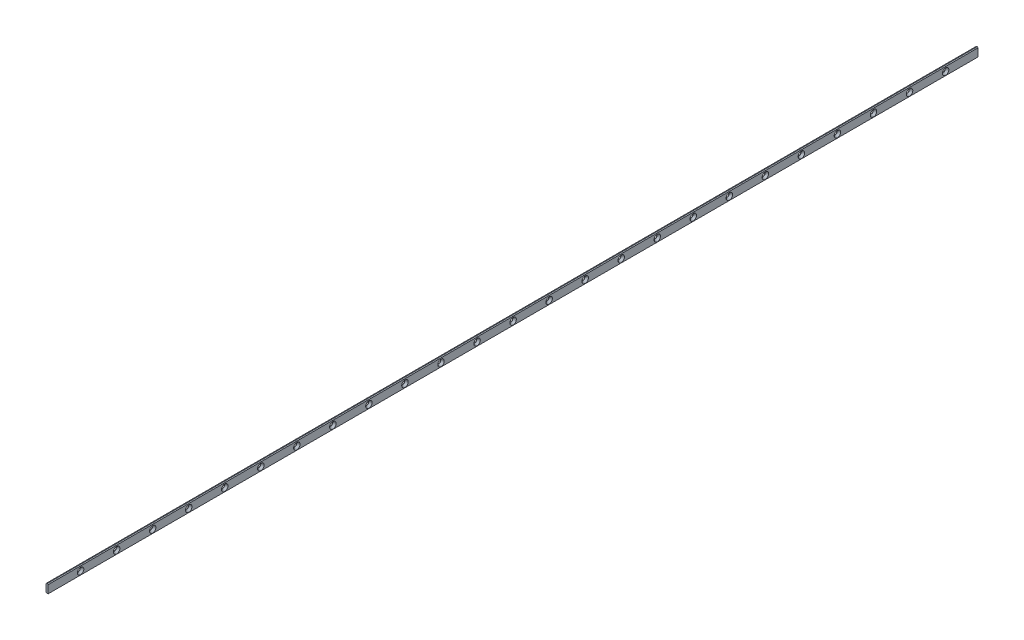
from build123d import *

# Parameters (mm, degrees)
SKETCH1_W                      = 3
SKETCH1_H                      = 12
BOSS_EXTRUDE1_DEPTH            = 645
SKETCH2_R                      = 2
CUT_EXTRUDE1_DEPTH             = 10
CHAMFER1_SIZE                  = 2.5
CHAMFER2_SIZE                  = 1
LPATTERN1_COUNT                = 13
LPATTERN1_PITCH                = 50
CHAMFER1_OF_LPATTERN1_SIZE     = 2.5
LPATTERN1_COL_COUNT            = 13
LPATTERN1_COL_PITCH            = 50
CHAMFER1_OF_LPATTERN1_COL_SIZE = 2.5


with BuildPart() as part:
    # Sketch1 → Boss-Extrude1 (new, symmetric)
    with BuildSketch(Plane.XY):
        Rectangle(SKETCH1_W, SKETCH1_H)
    extrude(amount=BOSS_EXTRUDE1_DEPTH, both=True)

    # Sketch2 → Cut-Extrude1 (cut)
    with BuildSketch(Plane(origin=(1.5, 0, 0), x_dir=(0, 0, -1), z_dir=(1, 0, 0))):
        with Locations((0, -1)):
            Circle(SKETCH2_R)
    cut_extrude1 = extrude(amount=-CUT_EXTRUDE1_DEPTH, mode=Mode.SUBTRACT)

    # Chamfer1
    chamfer1_edges = [part.edges().sort_by_distance(p)[0] for p in [
        (1.5, -1, 2),
    ]]
    chamfer(chamfer1_edges, length=CHAMFER1_SIZE)

    # Chamfer2
    chamfer2_edges = [part.edges().sort_by_distance(p)[0] for p in [
        (-1.5, 6, 0),
        (1.5, 6, 0),
    ]]
    chamfer(chamfer2_edges, length=CHAMFER2_SIZE)

    # LPattern1: Cut-Extrude1 ×13
    with Locations(*[(0, 0, -i * LPATTERN1_PITCH) for i in range(1, LPATTERN1_COUNT)]):
        add(cut_extrude1, mode=Mode.SUBTRACT)

    # Chamfer1 of LPattern1
    chamfer1_of_lpattern1_edges = [part.edges().sort_by_distance(p)[0] for p in [
        (1.5, -1, -48),
        (1.5, -1, -98),
        (1.5, -1, -148),
        (1.5, -1, -198),
        (1.5, -1, -248),
        (1.5, -1, -298),
        (1.5, -1, -348),
        (1.5, -1, -398),
        (1.5, -1, -448),
        (1.5, -1, -498),
        (1.5, -1, -548),
        (1.5, -1, -598),
    ]]
    chamfer(chamfer1_of_lpattern1_edges, length=CHAMFER1_OF_LPATTERN1_SIZE)

    # LPattern1 col: Cut-Extrude1 ×13
    with Locations(*[(0, 0, i * LPATTERN1_COL_PITCH) for i in range(1, LPATTERN1_COL_COUNT)]):
        add(cut_extrude1, mode=Mode.SUBTRACT)

    # Chamfer1 of LPattern1 col
    chamfer1_of_lpattern1_col_edges = [part.edges().sort_by_distance(p)[0] for p in [
        (1.5, -1, 52),
        (1.5, -1, 102),
        (1.5, -1, 152),
        (1.5, -1, 202),
        (1.5, -1, 252),
        (1.5, -1, 302),
        (1.5, -1, 352),
        (1.5, -1, 402),
        (1.5, -1, 452),
        (1.5, -1, 502),
        (1.5, -1, 552),
        (1.5, -1, 602),
    ]]
    chamfer(chamfer1_of_lpattern1_col_edges, length=CHAMFER1_OF_LPATTERN1_COL_SIZE)


solid = part.part
